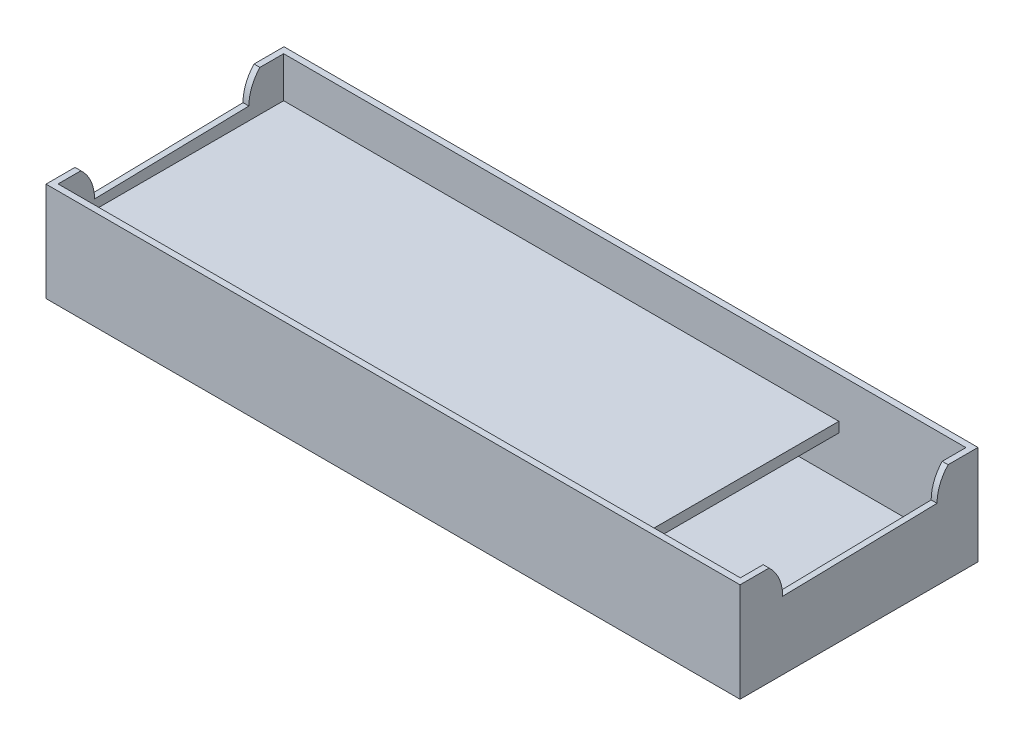
from build123d import *

# Parameters (mm, degrees)
SKETCH1_W           = 175
SKETCH1_H           = 60
BOSS_EXTRUDE1_DEPTH = 25
SKETCH2_W           = 172.037419054
SKETCH2_H           = 56.878309912
CUT_EXTRUDE2_DEPTH  = 23
CUT_EXTRUDE4_DEPTH  = 180.30421077
SKETCH5_W           = 56.619672169
SKETCH5_H           = 2.543260903
BOSS_EXTRUDE2_DEPTH = 140


with BuildPart() as part:
    # Sketch1 → Boss-Extrude1 (new body)
    with BuildSketch(Plane(origin=(0, 0, 0), x_dir=(1, 0, 0), z_dir=(0, 1, 0))):
        Rectangle(SKETCH1_W, SKETCH1_H)
    extrude(amount=BOSS_EXTRUDE1_DEPTH)

    # Sketch2 → Cut-Extrude2 (cut)
    with BuildSketch(Plane(origin=(0, 25, 0), x_dir=(1, 0, 0), z_dir=(0, 1, 0))):
        Rectangle(SKETCH2_W, SKETCH2_H)
    extrude(amount=-CUT_EXTRUDE2_DEPTH, mode=Mode.SUBTRACT)

    # Sketch3 → Cut-Extrude4 (cut, through all)
    with BuildSketch(Plane(origin=(87.5, 0, 0), x_dir=(0, 0, -1), z_dir=(1, 0, 0))):
        with BuildLine():
            ThreePointArc((-22.681609782, 25), (-20.139304377, 21.416181436), (-19.241971202, 17.114801954))
            Line((-19.241971202, 17.114801954), (19.672994279, 17.951296347))
            ThreePointArc((19.672994279, 17.951296347), (20.393002527, 21.739785058), (22.452628009, 25))
            Line((22.452628009, 25), (-22.681609782, 25))
        make_face()
    extrude(amount=-CUT_EXTRUDE4_DEPTH, mode=Mode.SUBTRACT)

    # Sketch5 → Boss-Extrude2 (add)
    with BuildSketch(Plane(origin=(-86.018709527, 0, 0), x_dir=(0, 0, -1), z_dir=(1, 0, 0))):
        with Locations((0.129318872, 13.450991009)):
            Rectangle(SKETCH5_W, SKETCH5_H)
    extrude(amount=BOSS_EXTRUDE2_DEPTH)


solid = part.part
